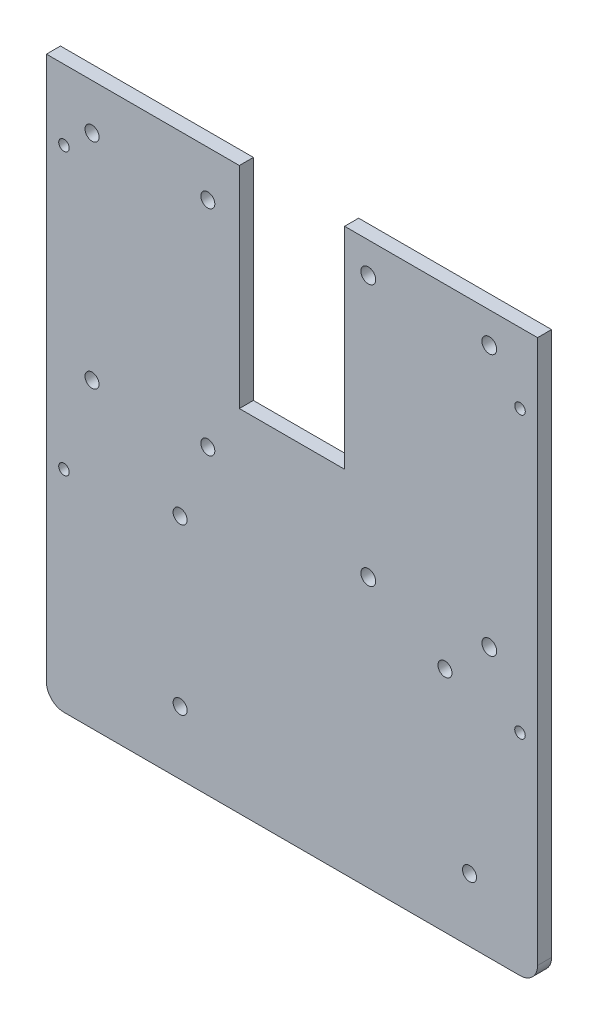
from build123d import *

# Parameters (mm, degrees)
SKETCH_1_W             = 140
SKETCH_1_H             = 200
SKETCH_1_R             = 1.5
EXTRUDE_1_DEPTH        = 4
SKETCH_2_W             = 20
SKETCH_2_H             = 20
EXTRUDE_2_DEPTH        = 4
FILLET_1_R             = 3
FILLET_1_OF_MIRROR_1_R = 3
SKETCH_3_W             = 8
SKETCH_3_H             = 30
SKETCH_3_R             = 1.75
EXTRUDE_3_DEPTH        = 4
FILLET_2_R             = 3
FILLET_2_OF_MIRROR_2_R = 3
FILLET_3_R             = 5
EXTRUDE_4_DEPTH        = 4
SKETCH_5_R             = 1.75
CUT_EXTRUDE_1_DEPTH    = 10
SKETCH_6_W             = 30
SKETCH_6_H             = 60
CUT_EXTRUDE_2_DEPTH    = 10
SKETCH_7_R             = 2.112337694
SKETCH_7_R_2           = 2
CUT_EXTRUDE_3_DEPTH    = 10


with BuildPart() as part:
    # 草图1 → 凸台-拉伸1 (new body)
    with BuildSketch(Plane.XY):
        Rectangle(SKETCH_1_W, SKETCH_1_H)
        with Locations((-65, 40)):
            Circle(SKETCH_1_R, mode=Mode.SUBTRACT)
        with Locations(Location((-65, -40, 0), (0, 0, 180))):
            Circle(SKETCH_1_R, mode=Mode.SUBTRACT)
        with Locations((65, -40)):
            Circle(SKETCH_1_R, mode=Mode.SUBTRACT)
        with Locations(Location((65, 40, 0), (0, 0, 180))):
            Circle(SKETCH_1_R, mode=Mode.SUBTRACT)
    extrude(amount=EXTRUDE_1_DEPTH)

    # 草图2 → 凸台-拉伸2 (add)
    with BuildSketch(Plane.XY.offset(4)):
        with Locations((80, 90)):
            Rectangle(SKETCH_2_W, SKETCH_2_H)
    extrude_2 = extrude(amount=-EXTRUDE_2_DEPTH)

    # 圆角1
    fillet_1_edges = [part.edges().sort_by_distance(p)[0] for p in [
        (90, 100, 2),
        (90, 80, 2),
    ]]
    fillet(fillet_1_edges, radius=FILLET_1_R)

    # 镜向1: 凸台-拉伸2 across plane
    add(extrude_2.mirror(Plane(origin=(0, 0, 0), x_dir=(0, 0, 1), z_dir=(1, 0, 0))))

    # 圆角1 of 镜向1
    fillet_1_of_mirror_1_edges = [part.edges().sort_by_distance(p)[0] for p in [
        (-90, 100, 2),
        (-90, 80, 2),
    ]]
    fillet(fillet_1_of_mirror_1_edges, radius=FILLET_1_OF_MIRROR_1_R)

    # 草图3 → 凸台-拉伸3 (add)
    with BuildSketch(Plane.XY.offset(4)):
        with Locations((-66, 115)):
            Rectangle(SKETCH_3_W, SKETCH_3_H)
        with Locations((-66, 126)):
            Circle(SKETCH_3_R, mode=Mode.SUBTRACT)
    extrude_3 = extrude(amount=-EXTRUDE_3_DEPTH)

    # 圆角2
    fillet_2_edges = [part.edges().sort_by_distance(p)[0] for p in [
        (-70, 100, 2),
        (-62, 100, 2),
    ]]
    fillet(fillet_2_edges, radius=FILLET_2_R)

    # 镜向2: 凸台-拉伸3 across plane
    add(extrude_3.mirror(Plane(origin=(0, 0, 0), x_dir=(0, 0, 1), z_dir=(1, 0, 0))))

    # 圆角2 of 镜向2
    fillet_2_of_mirror_2_edges = [part.edges().sort_by_distance(p)[0] for p in [
        (70, 100, 2),
        (62, 100, 2),
    ]]
    fillet(fillet_2_of_mirror_2_edges, radius=FILLET_2_OF_MIRROR_2_R)

    # 圆角3
    fillet_3_edges = [part.edges().sort_by_distance(p)[0] for p in [
        (-70, -100, 2),
        (70, -100, 2),
    ]]
    fillet(fillet_3_edges, radius=FILLET_3_R)

    # 草图4 → 凸台-拉伸4 (add)
    with BuildSketch(Plane(origin=(0, 0, 0), x_dir=(-1, 0, 0), z_dir=(0, 0, -1))):
        with BuildLine():
            add(Edge.make_bspline(
                [(-33.786379938, 100), (-33.384771108, 111.24314249), (-38.944167614, 121.897129031), (-48.25387443, 128.002822688)],
                knots=[0, 0, 0, 0, 0.66194058, 0.66194058, 0.66194058, 0.66194058], degree=3))
            Line((-33.786379938, 100), (0, 100))
            ThreePointArc((0, 100), (-9.331566745, 102.310402433), (-16.507166038, 108.707813791))
            ThreePointArc((-16.507166038, 108.707813791), (-29.663945789, 122.555538901), (-46.506293223, 131.566403293))
            ThreePointArc((-46.506293223, 131.566403293), (-48.952735362, 130.555841868), (-48.25387443, 128.002822688))
        make_face()
        with BuildLine():
            ThreePointArc((16.507166038, 108.707813791), (9.331566745, 102.310402433), (0, 100))
            Line((0, 100), (33.786379938, 100))
            add(Edge.make_bspline(
                [(33.786379938, 100), (33.384771108, 111.24314249), (38.944167614, 121.897129031), (48.25387443, 128.002822688)],
                knots=[0, 0, 0, 0, 0.66194058, 0.66194058, 0.66194058, 0.66194058], degree=3))
            ThreePointArc((48.25387443, 128.002822688), (48.952735362, 130.555841868), (46.506293223, 131.566403293))
            ThreePointArc((46.506293223, 131.566403293), (29.663945789, 122.555538901), (16.507166038, 108.707813791))
        make_face()
    extrude(amount=-EXTRUDE_4_DEPTH)

    # 草图5 → 切除-拉伸1 (cut)
    with BuildSketch(Plane(origin=(0, 0, 0), x_dir=(-1, 0, 0), z_dir=(0, 0, -1))):
        with BuildLine():
            Line((-70, 80), (-70, 60))
            Line((-70, 60), (70, 60))
            Line((70, 60), (70, 80))
            Line((70, 80), (87, 80))
            ThreePointArc((87, 80), (89.121320344, 80.878679656), (90, 83))
            Line((90, 83), (90, 97))
            ThreePointArc((90, 97), (89.121320344, 99.121320344), (87, 100))
            Line((87, 100), (73, 100))
            ThreePointArc((73, 100), (70.878679656, 100.878679656), (70, 103))
            Line((70, 103), (70, 130))
            Line((70, 130), (62, 130))
            Line((62, 130), (62, 103))
            ThreePointArc((62, 103), (61.121320344, 100.878679656), (59, 100))
            Line((59, 100), (33.786379938, 100))
            add(Edge.make_bspline(
                [(33.786379938, 100), (33.384771108, 111.24314249), (38.944167614, 121.897129031), (48.25387443, 128.002822688)],
                knots=[0, 0, 0, 0, 0.66194058, 0.66194058, 0.66194058, 0.66194058], degree=3))
            ThreePointArc((48.25387443, 128.002822688), (48.952735362, 130.555841868), (46.506293223, 131.566403293))
            ThreePointArc((46.506293223, 131.566403293), (29.663945789, 122.555538901), (16.507166038, 108.707813791))
            ThreePointArc((16.507166038, 108.707813791), (0, 100), (-16.507166038, 108.707813791))
            ThreePointArc((-16.507166038, 108.707813791), (-29.663945789, 122.555538901), (-46.506293223, 131.566403293))
            ThreePointArc((-46.506293223, 131.566403293), (-48.952735362, 130.555841868), (-48.25387443, 128.002822688))
            add(Edge.make_bspline(
                [(-48.25387443, 128.002822688), (-38.944167614, 121.897129031), (-33.384771108, 111.24314249), (-33.786379938, 100)],
                knots=[0, 0, 0, 0, 0.66194058, 0.66194058, 0.66194058, 0.66194058], degree=3))
            Line((-33.786379938, 100), (-59, 100))
            ThreePointArc((-59, 100), (-61.121320344, 100.878679656), (-62, 103))
            Line((-62, 103), (-62, 130))
            Line((-62, 130), (-70, 130))
            Line((-70, 130), (-70, 103))
            ThreePointArc((-70, 103), (-70.878679656, 100.878679656), (-73, 100))
            Line((-73, 100), (-87, 100))
            ThreePointArc((-87, 100), (-89.121320344, 99.121320344), (-90, 97))
            Line((-90, 97), (-90, 83))
            ThreePointArc((-90, 83), (-89.121320344, 80.878679656), (-87, 80))
            Line((-87, 80), (-70, 80))
        make_face()
        with Locations((-66, 126)):
            Circle(SKETCH_5_R, mode=Mode.SUBTRACT)
        with Locations((66, 126)):
            Circle(SKETCH_5_R, mode=Mode.SUBTRACT)
    extrude(amount=-CUT_EXTRUDE_1_DEPTH, mode=Mode.SUBTRACT)

    # 草图6 → 切除-拉伸2 (cut)
    with BuildSketch(Plane(origin=(0, 0, 0), x_dir=(-1, 0, 0), z_dir=(0, 0, -1))):
        with Locations((0, 30)):
            Rectangle(SKETCH_6_W, SKETCH_6_H)
    extrude(amount=-CUT_EXTRUDE_2_DEPTH, mode=Mode.SUBTRACT)

    # 草图7 → 切除-拉伸3 (cut)
    with BuildSketch(Plane.XY.offset(4)):
        with Locations((56.25, 51.25)):
            Circle(SKETCH_7_R)
        with Locations((56.25, -23.25)):
            Circle(SKETCH_7_R)
        with Locations((21.75, 51.25)):
            Circle(SKETCH_7_R)
        with Locations((21.75, -23.25)):
            Circle(SKETCH_7_R)
        with Locations((43.610044526, -35)):
            Circle(SKETCH_7_R_2)
        with Locations((50.610044526, -82)):
            Circle(SKETCH_7_R_2)
        with Locations((-31.889955474, -35)):
            Circle(SKETCH_7_R_2)
        with Locations((-31.889955474, -82)):
            Circle(SKETCH_7_R_2)
        with Locations((-24, 47)):
            Circle(SKETCH_7_R_2)
        with Locations((-57, 47)):
            Circle(SKETCH_7_R_2)
        with Locations((-24, -14)):
            Circle(SKETCH_7_R_2)
        with Locations((-57, -14)):
            Circle(SKETCH_7_R_2)
    extrude(amount=-CUT_EXTRUDE_3_DEPTH, mode=Mode.SUBTRACT)


solid = part.part
